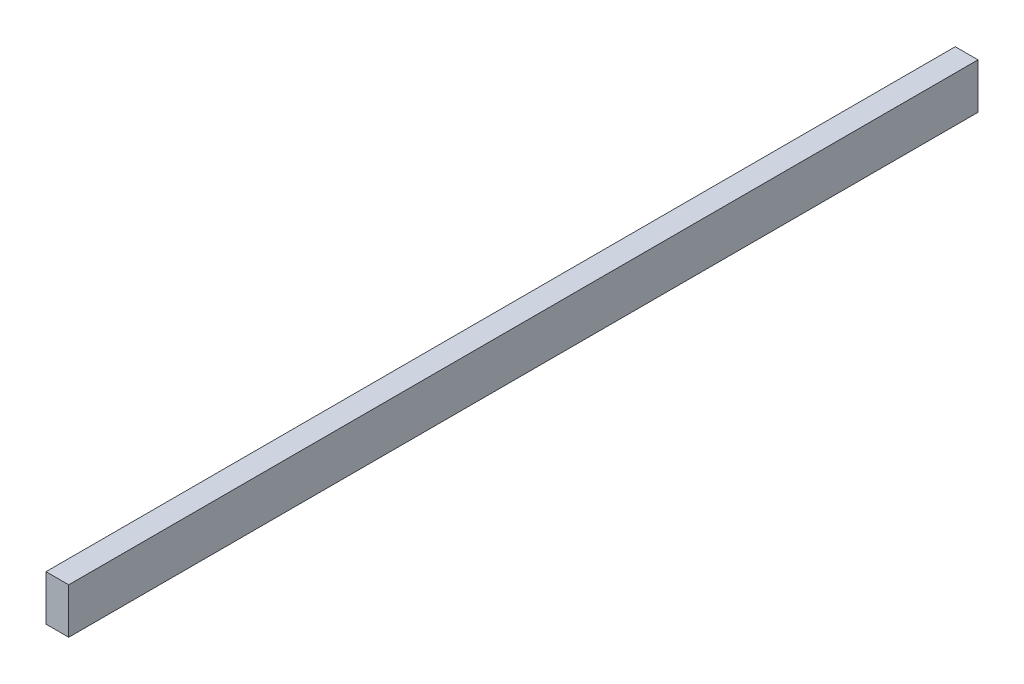
from build123d import *

# Parameters (mm, degrees)
ESQUISSE1_W        = 50
ESQUISSE1_H        = 100
BOSS_EXTRU_1_DEPTH = 2000


with BuildPart() as part:
    # Esquisse1 → Boss.-Extru.1 (new body)
    with BuildSketch(Plane.XY):
        with Locations((25, 50)):
            Rectangle(ESQUISSE1_W, ESQUISSE1_H)
    extrude(amount=BOSS_EXTRU_1_DEPTH)


solid = part.part
